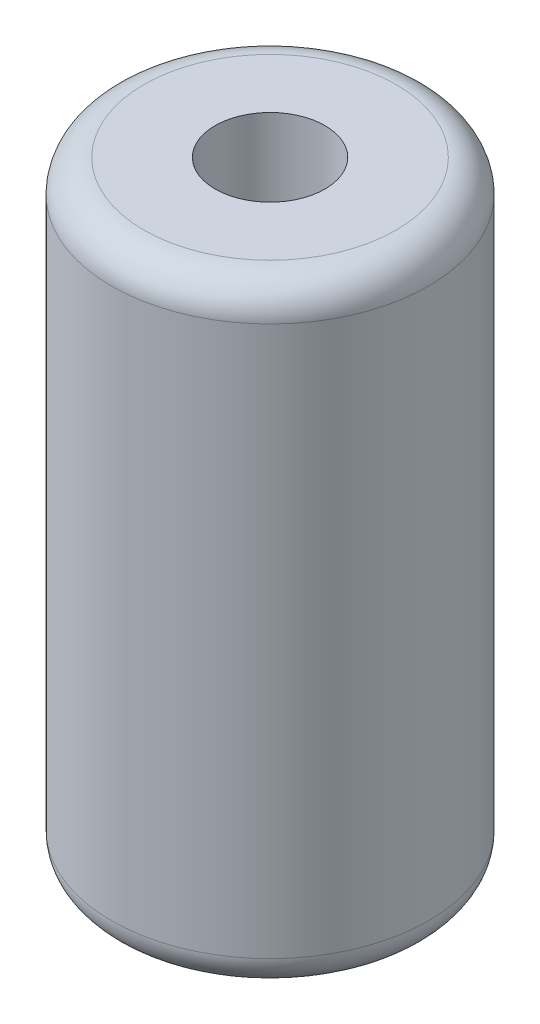
from build123d import *

# Parameters (mm, degrees)
SKETCH_1_R      = 4.9
SKETCH_1_R_2    = 1.7
EXTRUDE_1_DEPTH = 19
FILLET_1_R      = 1


with BuildPart() as part:
    # 草图1 → 凸台-拉伸1 (new body)
    with BuildSketch(Plane(origin=(0, 0, 0), x_dir=(1, 0, 0), z_dir=(0, 1, 0))):
        with Locations(Location((0, 0, 0), (0, 0, 270))):
            Circle(SKETCH_1_R)
        with Locations(Location((0, 0, 0), (0, 0, 270))):
            Circle(SKETCH_1_R_2, mode=Mode.SUBTRACT)
    extrude(amount=EXTRUDE_1_DEPTH)

    # 圆角1
    fillet_1_edges = [part.edges().sort_by_distance(p)[0] for p in [
        (0, 0, -4.9),
        (0, 19, -4.9),
    ]]
    fillet(fillet_1_edges, radius=FILLET_1_R)


solid = part.part
